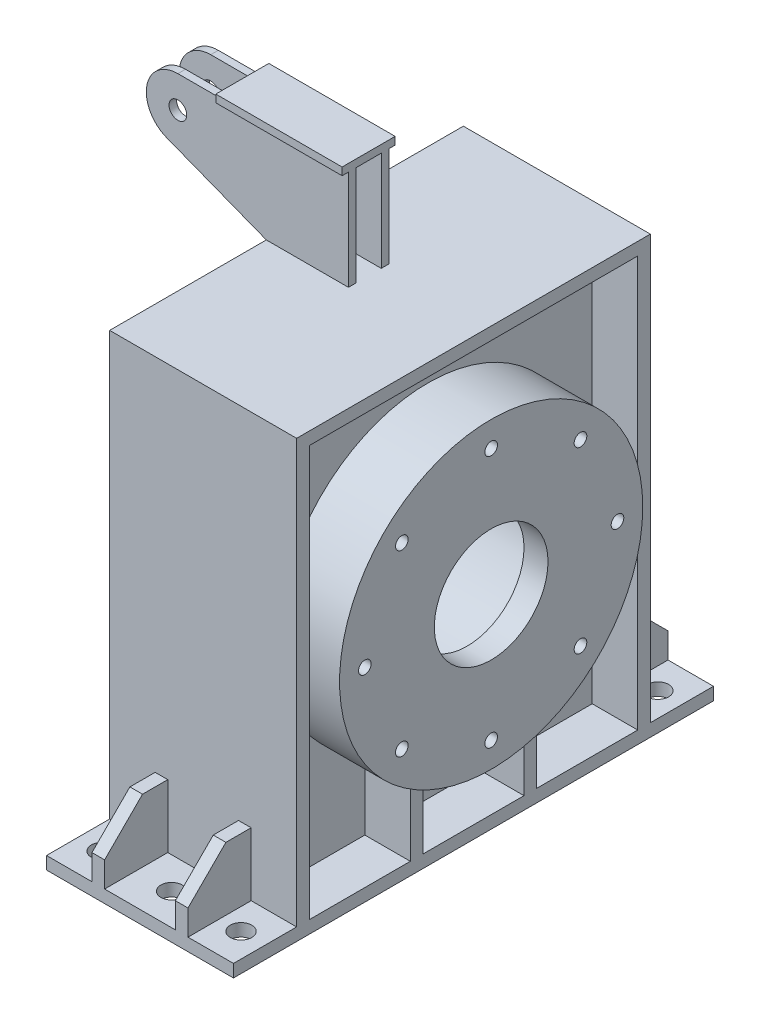
from build123d import *

# Parameters (mm, degrees)
SKETCH_1_W               = 100
SKETCH_1_H               = 42
EXTRUDE_1_DEPTH          = 6
SKETCH_2_W               = 200
SKETCH_2_H               = 6
EXTRUDE_2_DEPTH          = 79
SKETCH_3_R               = 7
CUT_EXTRUDE_1_DEPTH      = 133.70267518
SKETCH_4_W               = 148
SKETCH_4_H               = 280
EXTRUDE_3_DEPTH          = 10
SKETCH_6_W               = 148
SKETCH_6_H               = 10
EXTRUDE_4_DEPTH          = 325
SKETCH_7_W               = 148
SKETCH_7_H               = 380
EXTRUDE_5_DEPTH          = 10
SKETCH_8_W               = 10
SKETCH_8_H               = 50
EXTRUDE_6_DEPTH          = 50
CUT_EXTRUDE_2_DEPTH      = 517.861683625
SKETCH_10_W              = 260
SKETCH_10_H              = 325
SKETCH_10_R              = 120
EXTRUDE_7_DEPTH          = 10
PATTERN_LINEAR_1_COUNT   = 2
PATTERN_LINEAR_1_PITCH   = 66
SKETCH_12_R              = 120
SKETCH_12_R_2            = 80
EXTRUDE_9_DEPTH          = 148
SKETCH_13_W              = 36
SKETCH_13_H              = 10
EXTRUDE_10_DEPTH         = 50
EXTRUDE_START            = -14
SKETCH_14_R              = 80
SKETCH_14_R_2            = 65
EXTRUDE_11_DEPTH         = 14
SKETCH_15_R              = 65
SKETCH_15_R_2            = 45
EXTRUDE_12_DEPTH         = 5
SKETCH_17_R              = 120
SKETCH_17_R_2            = 45
EXTRUDE_13_DEPTH         = 14
SKETCH_18_R              = 80
SKETCH_18_R_2            = 65
EXTRUDE_14_DEPTH         = 14
SKETCH_19_R              = 65
SKETCH_19_R_2            = 25
EXTRUDE_15_DEPTH         = 5
EXTRUDE_START_2          = 14
SKETCH_20_R              = 120
SKETCH_20_R_2            = 25
EXTRUDE_16_DEPTH         = 14
SKETCH_27_R              = 8.5
CUT_EXTRUDE_4_DEPTH      = 10
SKETCH_28_R              = 5
CUT_EXTRUDE_5_DEPTH      = 25
CUT_EXTRUDE_START        = -25
SKETCH_29_R              = 5
CUT_EXTRUDE_6_DEPTH      = 25
PATTERN_CIRCULAR_2_COUNT = 8


with BuildPart() as part:
    # 草图1 → 凸台-拉伸1 (new body)
    with BuildSketch(Plane(origin=(0, 0, 0), x_dir=(1, 0, 0), z_dir=(0, 1, 0))):
        with Locations((50, 21)):
            Rectangle(SKETCH_1_W, SKETCH_1_H)
    extrude(amount=EXTRUDE_1_DEPTH)

    # 草图2 → 凸台-拉伸2 (add)
    with BuildSketch(Plane(origin=(0, 0, 0), x_dir=(1, 0, 0), z_dir=(0, 1, 0))):
        with Locations((0, 34)):
            Rectangle(SKETCH_2_W, SKETCH_2_H)
        with Locations((0, 8)):
            Rectangle(SKETCH_2_W, SKETCH_2_H)
    extrude(amount=-EXTRUDE_2_DEPTH)

    # 草图3 → 切除-拉伸1 (cut, through all)
    with BuildSketch(Plane.XY.offset(-5)):
        with Locations((-35, -25)):
            Circle(SKETCH_3_R)
        with BuildLine():
            Line((-44.049345139, -48.304706661), (35, -79))
            Line((35, -79), (-100, -79))
            Line((-100, -79), (-100, 0))
            Line((-100, 0), (-35, 0))
            ThreePointArc((-35, 0), (-59.572521915, -20.396613558), (-44.049345139, -48.304706661))
        make_face()
    extrude(amount=-CUT_EXTRUDE_1_DEPTH, mode=Mode.SUBTRACT)

    # 草图4 → 凸台-拉伸3 (add)
    with BuildSketch(Plane(origin=(0, -79, 0), x_dir=(-1, 0, 0), z_dir=(0, -1, 0))):
        with Locations((-109, 21)):
            Rectangle(SKETCH_4_W, SKETCH_4_H)
    extrude(amount=EXTRUDE_3_DEPTH)

    # 草图6 → 凸台-拉伸4 (add)
    with BuildSketch(Plane(origin=(0, -89, 0), x_dir=(-1, 0, 0), z_dir=(0, -1, 0))):
        with Locations((-109, -114)):
            Rectangle(SKETCH_6_W, SKETCH_6_H)
        with Locations((-109, 156)):
            Rectangle(SKETCH_6_W, SKETCH_6_H)
    extrude(amount=EXTRUDE_4_DEPTH)

    # 草图7 → 凸台-拉伸5 (add)
    with BuildSketch(Plane(origin=(0, -414, 0), x_dir=(-1, 0, 0), z_dir=(0, -1, 0))):
        with Locations((-109, 21)):
            Rectangle(SKETCH_7_W, SKETCH_7_H)
    extrude(amount=EXTRUDE_5_DEPTH)

    # 草图8 → 凸台-拉伸6 (add)
    with BuildSketch(Plane(origin=(0, -414, 0), x_dir=(1, 0, 0), z_dir=(0, 1, 0))):
        with Locations((76, 186)):
            Rectangle(SKETCH_8_W, SKETCH_8_H)
        with Locations((142, 186)):
            Rectangle(SKETCH_8_W, SKETCH_8_H)
        with Locations((76, -144)):
            Rectangle(SKETCH_8_W, SKETCH_8_H)
        with Locations((142, -144)):
            Rectangle(SKETCH_8_W, SKETCH_8_H)
    extrude(amount=EXTRUDE_6_DEPTH)

    # 草图9 → 切除-拉伸2 (cut, through all)
    with BuildSketch(Plane(origin=(147, 0, 0), x_dir=(0, 0, -1), z_dir=(1, 0, 0))):
        Polygon((211, -364), (181, -364), (211, -394), align=None)
        Polygon((-169, -364), (-139, -364), (-169, -394), align=None)
    extrude(amount=-CUT_EXTRUDE_2_DEPTH, mode=Mode.SUBTRACT)

    # 草图10 → 凸台-拉伸7 (add)
    with BuildSketch(Plane(origin=(147, 0, 0), x_dir=(0, 0, -1), z_dir=(1, 0, 0))):
        with Locations((21, -251.5)):
            Rectangle(SKETCH_10_W, SKETCH_10_H)
        with Locations((21, -249)):
            Circle(SKETCH_10_R, mode=Mode.SUBTRACT)
    extrude_7 = extrude(amount=-EXTRUDE_7_DEPTH)

    # 阵列(线性)1: 凸台-拉伸7 ×2
    with Locations(*[(-i * PATTERN_LINEAR_1_PITCH, 0, 0) for i in range(1, PATTERN_LINEAR_1_COUNT)]):
        add(extrude_7)



with BuildPart() as body_2:
    # 草图12 → 凸台-拉伸9 (new body)
    with BuildSketch(Plane.ZY.offset(-35)):
        with Locations(Location((-21, -249, 0), (0, 0, 180))):
            Circle(SKETCH_12_R)
        with Locations((-21, -249)):
            Circle(SKETCH_12_R_2, mode=Mode.SUBTRACT)
    extrude(amount=-EXTRUDE_9_DEPTH)


with BuildPart() as part_1:
    add(part.part)

    add(body_2.part)  # 凸台-拉伸10 merges body 2
    # 草图13 → 凸台-拉伸10 (add)
    with BuildSketch(Plane(origin=(0, -414, 0), x_dir=(1, 0, 0), z_dir=(0, 1, 0))):
        with Locations((165, -24)):
            Rectangle(SKETCH_13_W, SKETCH_13_H)
        with Locations((165, 66)):
            Rectangle(SKETCH_13_W, SKETCH_13_H)
        with Locations((53, 66)):
            Rectangle(SKETCH_13_W, SKETCH_13_H)
        with Locations((53, -24)):
            Rectangle(SKETCH_13_W, SKETCH_13_H)
    extrude(amount=EXTRUDE_10_DEPTH)

    # 草图14 → 凸台-拉伸11 (add)
    with BuildSketch(Plane(origin=(183, 0, 0), x_dir=(0, 0, -1), z_dir=(1, 0, 0)).offset(EXTRUDE_START)):
        with Locations(Location((21, -249, 0), (0, 0, 180))):
            Circle(SKETCH_14_R)
        with Locations((21, -249)):
            Circle(SKETCH_14_R_2, mode=Mode.SUBTRACT)
    extrude(amount=EXTRUDE_11_DEPTH)



with BuildPart() as body_2_2:
    # 草图15 → 凸台-拉伸12 (new body)
    with BuildSketch(Plane(origin=(183, 0, 0), x_dir=(0, 0, -1), z_dir=(1, 0, 0))):
        with Locations((21, -249)):
            Circle(SKETCH_15_R)
        with Locations((21, -249)):
            Circle(SKETCH_15_R_2, mode=Mode.SUBTRACT)
    extrude(amount=-EXTRUDE_12_DEPTH)


with BuildPart() as part_2:
    add(part_1.part)

    add(body_2_2.part)  # 凸台-拉伸13 merges body 2 2
    # 草图17 → 凸台-拉伸13 (add)
    with BuildSketch(Plane(origin=(183, 0, 0), x_dir=(0, 0, -1), z_dir=(1, 0, 0))):
        with Locations(Location((21, -249, 0), (0, 0, 180))):
            Circle(SKETCH_17_R)
        with Locations((21, -249)):
            Circle(SKETCH_17_R_2, mode=Mode.SUBTRACT)
    extrude(amount=EXTRUDE_13_DEPTH)

    # 草图18 → 凸台-拉伸14 (add)
    with BuildSketch(Plane.ZY.offset(-35)):
        with Locations((-21, -249)):
            Circle(SKETCH_18_R)
        with Locations(Location((-21, -249, 0), (0, 0, 180))):
            Circle(SKETCH_18_R_2, mode=Mode.SUBTRACT)
    extrude(amount=-EXTRUDE_14_DEPTH)



with BuildPart() as body_2_3:
    # 草图19 → 凸台-拉伸15 (new body)
    with BuildSketch(Plane.ZY.offset(-35)):
        with Locations(Location((-21, -249, 0), (0, 0, 180))):
            Circle(SKETCH_19_R)
        with Locations((-21, -249)):
            Circle(SKETCH_19_R_2, mode=Mode.SUBTRACT)
    extrude(amount=-EXTRUDE_15_DEPTH)


with BuildPart() as part_3:
    add(part_2.part)

    add(body_2_3.part)  # 凸台-拉伸16 merges body 2 3
    # 草图20 → 凸台-拉伸16 (add)
    with BuildSketch(Plane.ZY.offset(-35).offset(EXTRUDE_START_2)):
        with Locations((-21, -249)):
            Circle(SKETCH_20_R)
        with Locations((-21, -249)):
            Circle(SKETCH_20_R_2, mode=Mode.SUBTRACT)
    extrude(amount=-EXTRUDE_16_DEPTH)

    # 草图27 → 切除-拉伸4 (cut)
    with BuildSketch(Plane(origin=(0, -424, 0), x_dir=(-1, 0, 0), z_dir=(0, -1, 0))):
        with Locations(Location((-109, -144, 0), (0, 0, 90))):
            Circle(SKETCH_27_R)
        with Locations(Location((-164, -144, 0), (0, 0, 90))):
            Circle(SKETCH_27_R)
        with Locations(Location((-54, -144, 0), (0, 0, 90))):
            Circle(SKETCH_27_R)
        with Locations(Location((-54, 186, 0), (0, 0, 90))):
            Circle(SKETCH_27_R)
        with Locations(Location((-109, 186, 0), (0, 0, 90))):
            Circle(SKETCH_27_R)
        with Locations(Location((-164, 186, 0), (0, 0, 90))):
            Circle(SKETCH_27_R)
        with Locations(Location((-54, 111, 0), (0, 0, 90))):
            Circle(SKETCH_27_R)
        with Locations(Location((-54, -69, 0), (0, 0, 90))):
            Circle(SKETCH_27_R)
        with Locations(Location((-54, 21, 0), (0, 0, 90))):
            Circle(SKETCH_27_R)
    extrude(amount=-CUT_EXTRUDE_4_DEPTH, mode=Mode.SUBTRACT)

    # 草图28 → 切除-拉伸5 (cut)
    with BuildSketch(Plane(origin=(197, 0, 0), x_dir=(0, 0, -1), z_dir=(1, 0, 0))):
        with Locations((21, -149)):
            Circle(SKETCH_28_R)
    cut_extrude_5 = extrude(amount=-CUT_EXTRUDE_5_DEPTH, mode=Mode.SUBTRACT)

    # 草图29 → 切除-拉伸6 (cut)
    with BuildSketch(Plane.ZY.offset(-21).offset(CUT_EXTRUDE_START)):
        with Locations(Location((-21, -149, 0), (0, 0, 180))):
            Circle(SKETCH_29_R)
    cut_extrude_6 = extrude(amount=CUT_EXTRUDE_6_DEPTH, mode=Mode.SUBTRACT)

    # 阵列(圆周)2: 切除-拉伸5, 切除-拉伸6 ×8 about axis
    pattern_circular_2_axis = Axis((0, -249, -21), (1, 0, 0))
    add([cut_extrude_5.rotate(pattern_circular_2_axis, i * 360 / PATTERN_CIRCULAR_2_COUNT) for i in range(1, PATTERN_CIRCULAR_2_COUNT)], mode=Mode.SUBTRACT)
    add([cut_extrude_6.rotate(pattern_circular_2_axis, i * 360 / PATTERN_CIRCULAR_2_COUNT) for i in range(1, PATTERN_CIRCULAR_2_COUNT)], mode=Mode.SUBTRACT)


solid = part_3.part
